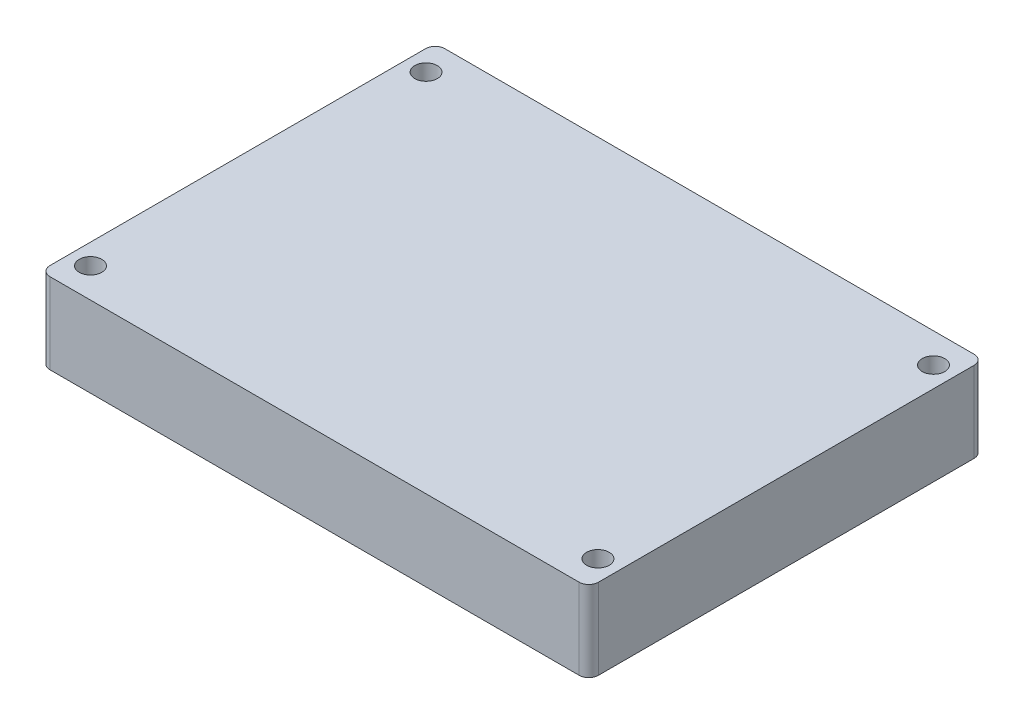
from build123d import *

# Parameters (mm, degrees)
SKETCH_1_R      = 1.75
EXTRUDE_1_DEPTH = 12.5


with BuildPart() as part:
    # 草图1 → 凸台-拉伸1 (new body)
    with BuildSketch(Plane(origin=(0, 0, 0), x_dir=(1, 0, 0), z_dir=(0, 1, 0))):
        with BuildLine():
            Line((41, -30.6), (-41, -30.6))
            ThreePointArc((-41, -30.6), (-42.060660172, -30.160660172), (-42.5, -29.1))
            Line((-42.5, -29.1), (-42.5, 29.1))
            ThreePointArc((-42.5, 29.1), (-42.060660172, 30.160660172), (-41, 30.6))
            Line((-41, 30.6), (41, 30.6))
            ThreePointArc((41, 30.6), (42.060660172, 30.160660172), (42.5, 29.1))
            Line((42.5, 29.1), (42.5, -29.1))
            ThreePointArc((42.5, -29.1), (42.060660172, -30.160660172), (41, -30.6))
        make_face()
        with Locations(Location((39.32, 26, 0), (0, 0, 270))):
            Circle(SKETCH_1_R, mode=Mode.SUBTRACT)
        with Locations(Location((39.32, -26, 0), (0, 0, 90))):
            Circle(SKETCH_1_R, mode=Mode.SUBTRACT)
        with Locations(Location((-39.32, -26, 0), (0, 0, 270))):
            Circle(SKETCH_1_R, mode=Mode.SUBTRACT)
        with Locations(Location((-39.32, 26, 0), (0, 0, 90))):
            Circle(SKETCH_1_R, mode=Mode.SUBTRACT)
    extrude(amount=EXTRUDE_1_DEPTH)


solid = part.part
